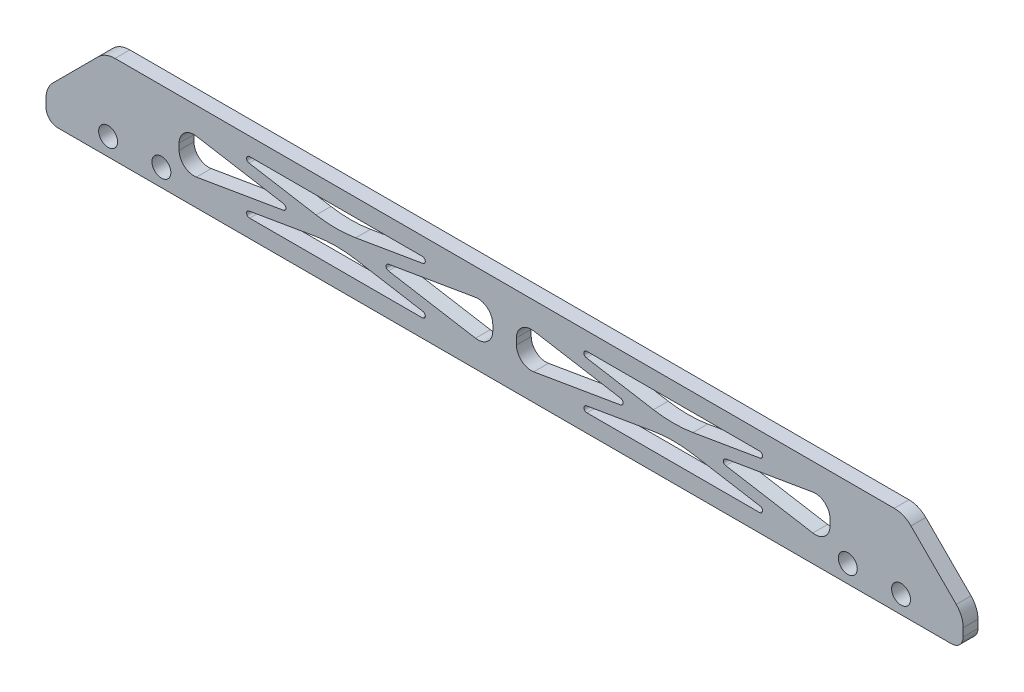
from build123d import *

# Parameters (mm, degrees)
SKETCH1_W           = 196.85
SKETCH1_H           = 19.05
SKETCH1_R           = 2.032
BOSS_EXTRUDE1_DEPTH = 3.175
CHAMFER1_SIZE       = 12.7
FILLET1_R           = 5.08
FILLET2_R           = 2.54
CUT_EXTRUDE1_REACH  = 100.936
FILLET3_R           = 3.175
FILLET4_R           = 0.635
FILLET5_R           = 25.4


with BuildPart() as part:
    # Sketch1 → Boss-Extrude1 (new body)
    with BuildSketch(Plane.XY):
        Rectangle(SKETCH1_W, SKETCH1_H)
        with Locations((-73.66, -5.715)):
            Circle(SKETCH1_R, mode=Mode.SUBTRACT)
        with Locations((-85.09, -5.715)):
            Circle(SKETCH1_R, mode=Mode.SUBTRACT)
        with Locations((73.66, -5.715)):
            Circle(SKETCH1_R, mode=Mode.SUBTRACT)
        with Locations((85.09, -5.715)):
            Circle(SKETCH1_R, mode=Mode.SUBTRACT)
    extrude(amount=BOSS_EXTRUDE1_DEPTH)

    # Chamfer1
    chamfer1_edges = [part.edges().sort_by_distance(p)[0] for p in [
        (-98.425, 9.525, 1.5875),
        (98.425, 9.525, 1.5875),
    ]]
    chamfer(chamfer1_edges, length=CHAMFER1_SIZE)

    # Fillet1
    fillet1_edges = [part.edges().sort_by_distance(p)[0] for p in [
        (-85.725, 9.525, 1.5875),
        (85.725, 9.525, 1.5875),
        (98.425, -3.175, 1.5875),
        (-98.425, -3.175, 1.5875),
    ]]
    fillet(fillet1_edges, radius=FILLET1_R)

    # Fillet2
    fillet2_edges = [part.edges().sort_by_distance(p)[0] for p in [
        (98.425, -9.525, 1.5875),
        (-98.425, -9.525, 1.5875),
    ]]
    fillet(fillet2_edges, radius=FILLET2_R)

    # Sketch2 → Cut-Extrude1 (cut, up to next)
    with BuildSketch(Plane.XY.offset(3.175), mode=Mode.PRIVATE) as cut_extrude1_sk1:
        Polygon((-62.264047257, 5.715), (-36.195, 1.288180654), (-10.125952743, 5.715), align=None)
    cut_extrude1_tool1 = extrude(cut_extrude1_sk1.sketch, amount=-CUT_EXTRUDE1_REACH, mode=Mode.PRIVATE) & part.part
    # Sketch2 → Cut-Extrude1 (cut, up to next)
    with BuildSketch(Plane.XY.offset(3.175), mode=Mode.PRIVATE) as cut_extrude1_sk2:
        Polygon((-69.85, 4.426819346), (-69.85, -4.426819346), (-43.780952743, 0), align=None)
    cut_extrude1_tool2 = extrude(cut_extrude1_sk2.sketch, amount=-CUT_EXTRUDE1_REACH, mode=Mode.PRIVATE) & part.part
    # Sketch2 → Cut-Extrude1 (cut, up to next)
    with BuildSketch(Plane.XY.offset(3.175), mode=Mode.PRIVATE) as cut_extrude1_sk3:
        Polygon((-36.195, -1.288180654), (-62.264047257, -5.715), (-10.125952743, -5.715), align=None)
    cut_extrude1_tool3 = extrude(cut_extrude1_sk3.sketch, amount=-CUT_EXTRUDE1_REACH, mode=Mode.PRIVATE) & part.part
    # Sketch2 → Cut-Extrude1 (cut, up to next)
    with BuildSketch(Plane.XY.offset(3.175), mode=Mode.PRIVATE) as cut_extrude1_sk4:
        Polygon((-2.54, 4.426819346), (-28.609047257, 0), (-2.54, -4.426819346), align=None)
    cut_extrude1_tool4 = extrude(cut_extrude1_sk4.sketch, amount=-CUT_EXTRUDE1_REACH, mode=Mode.PRIVATE) & part.part
    # Sketch2 → Cut-Extrude1 (cut, up to next)
    with BuildSketch(Plane.XY.offset(3.175), mode=Mode.PRIVATE) as cut_extrude1_sk5:
        Polygon((2.54, 4.426819346), (2.54, -4.426819346), (28.609047257, 0), align=None)
    cut_extrude1_tool5 = extrude(cut_extrude1_sk5.sketch, amount=-CUT_EXTRUDE1_REACH, mode=Mode.PRIVATE) & part.part
    # Sketch2 → Cut-Extrude1 (cut, up to next)
    with BuildSketch(Plane.XY.offset(3.175), mode=Mode.PRIVATE) as cut_extrude1_sk6:
        Polygon((62.264047257, 5.715), (10.125952743, 5.715), (36.195, 1.288180654), align=None)
    cut_extrude1_tool6 = extrude(cut_extrude1_sk6.sketch, amount=-CUT_EXTRUDE1_REACH, mode=Mode.PRIVATE) & part.part
    # Sketch2 → Cut-Extrude1 (cut, up to next)
    with BuildSketch(Plane.XY.offset(3.175), mode=Mode.PRIVATE) as cut_extrude1_sk7:
        Polygon((69.85, 4.426819346), (43.780952743, 0), (69.85, -4.426819346), align=None)
    cut_extrude1_tool7 = extrude(cut_extrude1_sk7.sketch, amount=-CUT_EXTRUDE1_REACH, mode=Mode.PRIVATE) & part.part
    # Sketch2 → Cut-Extrude1 (cut, up to next)
    with BuildSketch(Plane.XY.offset(3.175), mode=Mode.PRIVATE) as cut_extrude1_sk8:
        Polygon((36.195, -1.288180654), (10.125952743, -5.715), (62.264047257, -5.715), align=None)
    cut_extrude1_tool8 = extrude(cut_extrude1_sk8.sketch, amount=-CUT_EXTRUDE1_REACH, mode=Mode.PRIVATE) & part.part
    add(cut_extrude1_tool1.solids().sort_by_distance((-36.195, 4.239394, 3.175))[0], mode=Mode.SUBTRACT)
    add(cut_extrude1_tool2.solids().sort_by_distance((-61.160318, 0, 3.175))[0], mode=Mode.SUBTRACT)
    add(cut_extrude1_tool3.solids().sort_by_distance((-36.195, -4.239394, 3.175))[0], mode=Mode.SUBTRACT)
    add(cut_extrude1_tool4.solids().sort_by_distance((-11.229682, 0, 3.175))[0], mode=Mode.SUBTRACT)
    add(cut_extrude1_tool5.solids().sort_by_distance((11.229682, 0, 3.175))[0], mode=Mode.SUBTRACT)
    add(cut_extrude1_tool6.solids().sort_by_distance((36.195, 4.239394, 3.175))[0], mode=Mode.SUBTRACT)
    add(cut_extrude1_tool7.solids().sort_by_distance((61.160318, 0, 3.175))[0], mode=Mode.SUBTRACT)
    add(cut_extrude1_tool8.solids().sort_by_distance((36.195, -4.239394, 3.175))[0], mode=Mode.SUBTRACT)

    # Fillet3
    fillet3_edges = [part.edges().sort_by_distance(p)[0] for p in [
        (2.54, -4.426819346, 1.5875),
        (2.54, 4.426819346, 1.5875),
        (-2.54, 4.426819346, 1.5875),
        (-2.54, -4.426819346, 1.5875),
        (-69.85, -4.426819346, 1.5875),
        (-69.85, 4.426819346, 1.5875),
        (69.85, 4.426819346, 1.5875),
        (69.85, -4.426819346, 1.5875),
    ]]
    fillet(fillet3_edges, radius=FILLET3_R)

    # Fillet4
    fillet4_edges = [part.edges().sort_by_distance(p)[0] for p in [
        (28.609047257, 0, 1.5875),
        (-28.609047257, 0, 1.5875),
        (-43.780952743, 0, 1.5875),
        (-62.264047257, -5.715, 1.5875),
        (-10.125952743, -5.715, 1.5875),
        (62.264047257, -5.715, 1.5875),
        (10.125952743, -5.715, 1.5875),
        (10.125952743, 5.715, 1.5875),
        (62.264047257, 5.715, 1.5875),
        (43.780952743, 0, 1.5875),
        (-62.264047257, 5.715, 1.5875),
        (-10.125952743, 5.715, 1.5875),
    ]]
    fillet(fillet4_edges, radius=FILLET4_R)

    # Fillet5
    fillet5_edges = [part.edges().sort_by_distance(p)[0] for p in [
        (-36.195, -1.288180654, 1.5875),
        (36.195, -1.288180654, 1.5875),
        (36.195, 1.288180654, 1.5875),
        (-36.195, 1.288180654, 1.5875),
    ]]
    fillet(fillet5_edges, radius=FILLET5_R)


solid = part.part
